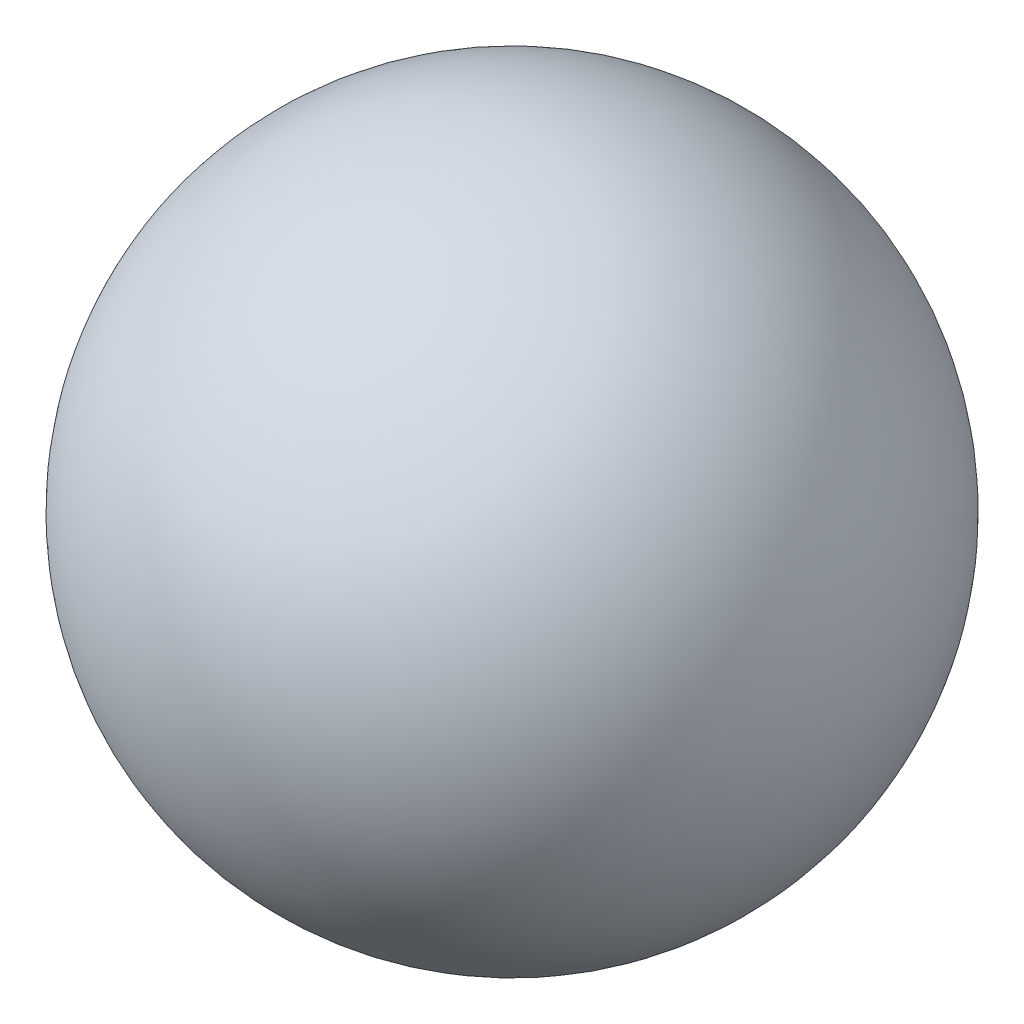
from build123d import *


with BuildPart() as part:
    # Çizim1 → Döndür1 (revolve)
    with BuildSketch(Plane.XY):
        with BuildLine():
            Line((2.8, 0), (-2.8, 0))
            ThreePointArc((-2.8, 0), (0, -2.8), (2.8, 0))
        make_face()
    revolve(axis=Axis((2.8, 0, 0), (-1, 0, 0)))


solid = part.part
